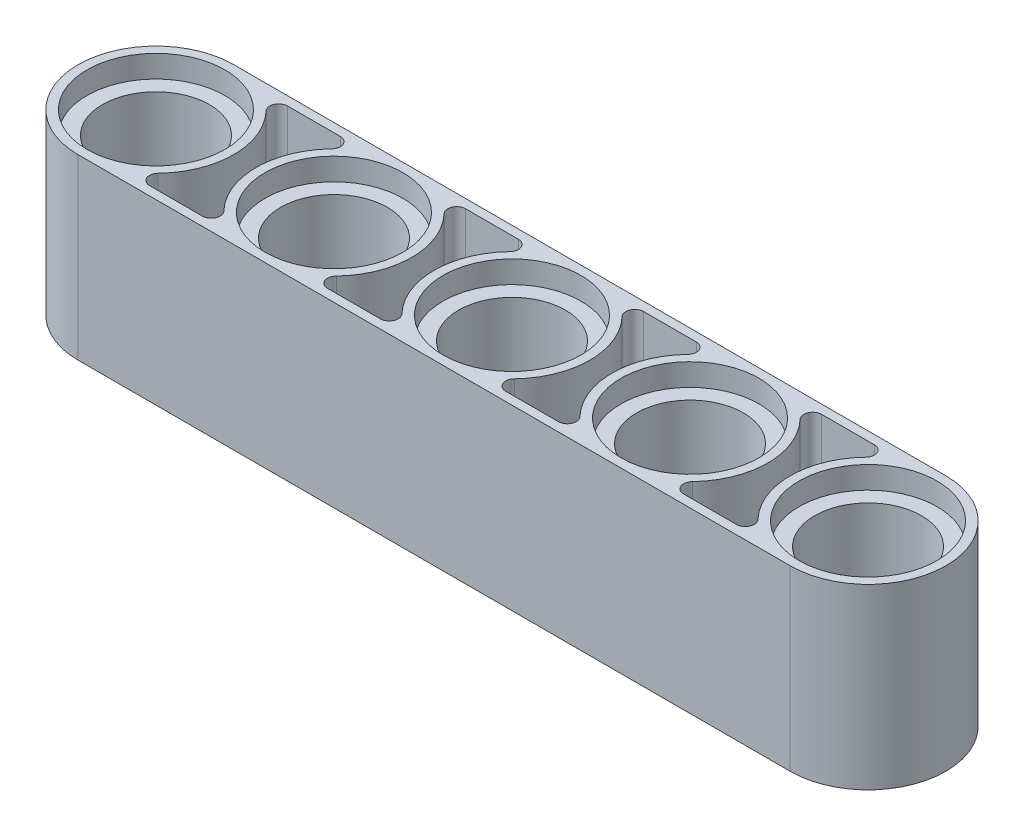
from build123d import *

# Parameters (mm, degrees)
BOSS_EXTRUDE1_DEPTH = 4
SKETCH3_R           = 3.1
CUT_EXTRUDE1_DEPTH  = 1
CUT_EXTRUDE2_START  = -1
SKETCH4_R           = 3.1
CUT_EXTRUDE2_DEPTH  = 1
SKETCH5_R           = 2.4
CUT_EXTRUDE3_DEPTH  = 37.558172821
LPATTERN2_COUNT     = 5
LPATTERN2_PITCH     = 8
CUT_EXTRUDE4_DEPTH  = 36.895682192
LPATTERN3_COUNT     = 4
LPATTERN3_PITCH     = 8


with BuildPart() as part:
    # Sketch2 → Boss-Extrude1 (new, symmetric)
    with BuildSketch(Plane(origin=(0, 0, 0), x_dir=(1, 0, 0), z_dir=(0, 1, 0))):
        with BuildLine():
            Line((0, 3.5), (32, 3.5))
            ThreePointArc((32, 3.5), (35.5, 0), (32, -3.5))
            Line((32, -3.5), (0, -3.5))
            ThreePointArc((0, -3.5), (-3.5, 0), (0, 3.5))
        make_face()
    extrude(amount=BOSS_EXTRUDE1_DEPTH, both=True)

    # Sketch3 → Cut-Extrude1 (cut)
    with BuildSketch(Plane(origin=(0, 4, 0), x_dir=(1, 0, 0), z_dir=(0, 1, 0))):
        with Locations(Location((0, 0, 0), (0, 0, 270))):
            Circle(SKETCH3_R)
    cut_extrude1 = extrude(amount=-CUT_EXTRUDE1_DEPTH, mode=Mode.SUBTRACT)

    # Sketch4 → Cut-Extrude2 (cut)
    with BuildSketch(Plane(origin=(0, -4, 0), x_dir=(-1, 0, 0), z_dir=(0, -1, 0)).offset(CUT_EXTRUDE2_START)):
        with Locations(Location((0, 0, 0), (0, 0, 270))):
            Circle(SKETCH4_R)
    cut_extrude2 = extrude(amount=CUT_EXTRUDE2_DEPTH, mode=Mode.SUBTRACT)

    # Sketch5 → Cut-Extrude3 (cut, through all)
    with BuildSketch(Plane(origin=(0, -4, 0), x_dir=(-1, 0, 0), z_dir=(0, -1, 0))):
        with Locations(Location((0, 0, 0), (0, 0, 90))):
            Circle(SKETCH5_R)
    cut_extrude3 = extrude(amount=-CUT_EXTRUDE3_DEPTH, mode=Mode.SUBTRACT)

    # LPattern2: Cut-Extrude1, Cut-Extrude2, Cut-Extrude3 ×5
    with Locations(*[(i * LPATTERN2_PITCH, 0, 0) for i in range(1, LPATTERN2_COUNT)]):
        add(cut_extrude1, mode=Mode.SUBTRACT)
        add(cut_extrude2, mode=Mode.SUBTRACT)
        add(cut_extrude3, mode=Mode.SUBTRACT)

    # Sketch6 → Cut-Extrude4 (cut, symmetric)
    with BuildSketch(Plane(origin=(0, 0, 0), x_dir=(1, 0, 0), z_dir=(0, 1, 0))):
        with BuildLine():
            Line((2.814249456, 3.1), (5.185750544, 3.1))
            ThreePointArc((5.185750544, 3.1), (5.553697029, 2.856892908), (5.474391514, 2.423076923))
            ThreePointArc((5.474391514, 2.423076923), (4.5, 0), (5.474391514, -2.423076923))
            ThreePointArc((5.474391514, -2.423076923), (5.553697029, -2.856892908), (5.185750544, -3.1))
            Line((5.185750544, -3.1), (2.814249456, -3.1))
            ThreePointArc((2.814249456, -3.1), (2.446302971, -2.856892908), (2.525608486, -2.423076923))
            ThreePointArc((2.525608486, -2.423076923), (3.5, 0), (2.525608486, 2.423076923))
            ThreePointArc((2.525608486, 2.423076923), (2.446302971, 2.856892908), (2.814249456, 3.1))
        make_face()
    cut_extrude4 = extrude(amount=CUT_EXTRUDE4_DEPTH, both=True, mode=Mode.SUBTRACT)

    # LPattern3: Cut-Extrude4 ×4
    with Locations(*[(i * LPATTERN3_PITCH, 0, 0) for i in range(1, LPATTERN3_COUNT)]):
        add(cut_extrude4, mode=Mode.SUBTRACT)


solid = part.part
